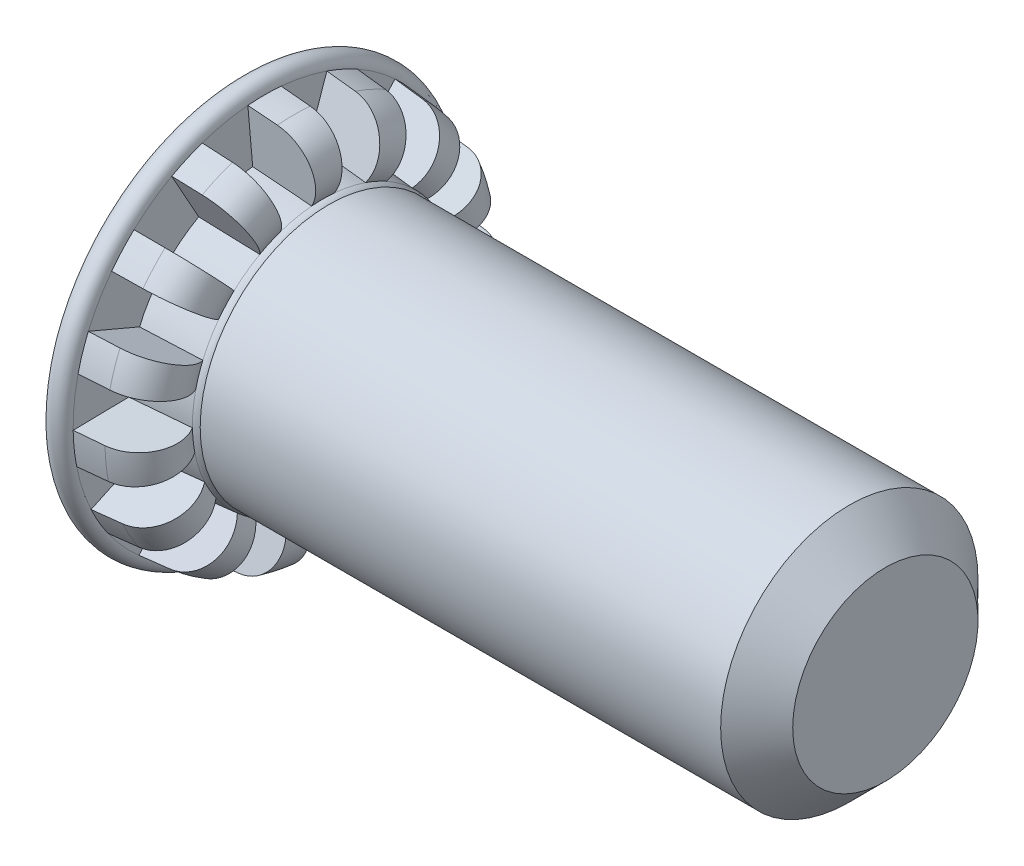
from build123d import *

# Parameters (mm, degrees)
BOSS_EXTRUDE1_START = 5
SKETCH2_R           = 2
BOSS_EXTRUDE1_DEPTH = 10
REVOLVE2_ANGLE      = 10
CIRPATTERN1_COUNT   = 15
CHAMFER1_SIZE       = 0.56


with BuildPart() as part:
    # Sketch2 → Boss-Extrude1 (new body)
    with BuildSketch(Plane(origin=(0, 0, 0), x_dir=(0, 0, -1), z_dir=(1, 0, 0)).offset(BOSS_EXTRUDE1_START)):
        Circle(SKETCH2_R)
    extrude(amount=-BOSS_EXTRUDE1_DEPTH)

    # Sketch5 → Revolve1 (revolve)
    with BuildSketch(Plane.XY, mode=Mode.PRIVATE) as revolve1_sk:
        with BuildLine():
            Line((-5, 0), (-5, 2.975))
            ThreePointArc((-5, 2.975), (-4.825, 3.15), (-4.65, 2.975))
            Line((-4.65, 2.975), (-4.65, 2.110172817))
            Line((-4.65, 2.110172817), (-3.740028773, 2.03056065))
            ThreePointArc((-3.740028773, 2.03056065), (-3.65, 2), (-3.584254841, 1.931321711))
            Line((-3.584254841, 1.931321711), (-2.469205731, 0))
            Line((-2.469205731, 0), (-5, 0))
        make_face()
    revolve(revolve1_sk.sketch.rotate(Axis((-5, 0, 0), (1, 0, 0)), 180), axis=Axis((-5, 0, 0), (1, 0, 0)))

    # Sketch6 → Revolve2 (revolve, symmetric)
    with BuildSketch(Plane.XY) as revolve2_sk:
        with BuildLine():
            Line((-4.65, 2.975), (-4.65, 0))
            Line((-4.65, 0), (-3.740028773, 0))
            Line((-3.740028773, 0), (-3.740028773, 2.03056065))
            ThreePointArc((-3.740028773, 2.03056065), (-3.715248765, 2.609757983), (-4.195014387, 2.935193917))
            Line((-4.195014387, 2.935193917), (-4.65, 2.975))
        make_face()
    revolve(axis=Axis((-4.65, 0, 0), (1, 0, 0)), revolution_arc=REVOLVE2_ANGLE / 2)
    revolve(revolve2_sk.sketch, axis=Axis((-4.65, 0, 0), (-1, 0, 0)), revolution_arc=REVOLVE2_ANGLE / 2)

    # CirPattern1: part ×15 about axis
    cirpattern1_axis = Axis((0, 0, 0), (1, 0, 0))


with BuildPart() as part_1:
    add(part.part)
    for i in range(1, CIRPATTERN1_COUNT):
        add(part.part.rotate(cirpattern1_axis, i * 360 / CIRPATTERN1_COUNT))

    # Chamfer1
    chamfer1_edges = [part_1.edges().sort_by_distance(p)[0] for p in [
        (5, 0, 2),
    ]]
    chamfer(chamfer1_edges, length=CHAMFER1_SIZE)


solid = part_1.part
